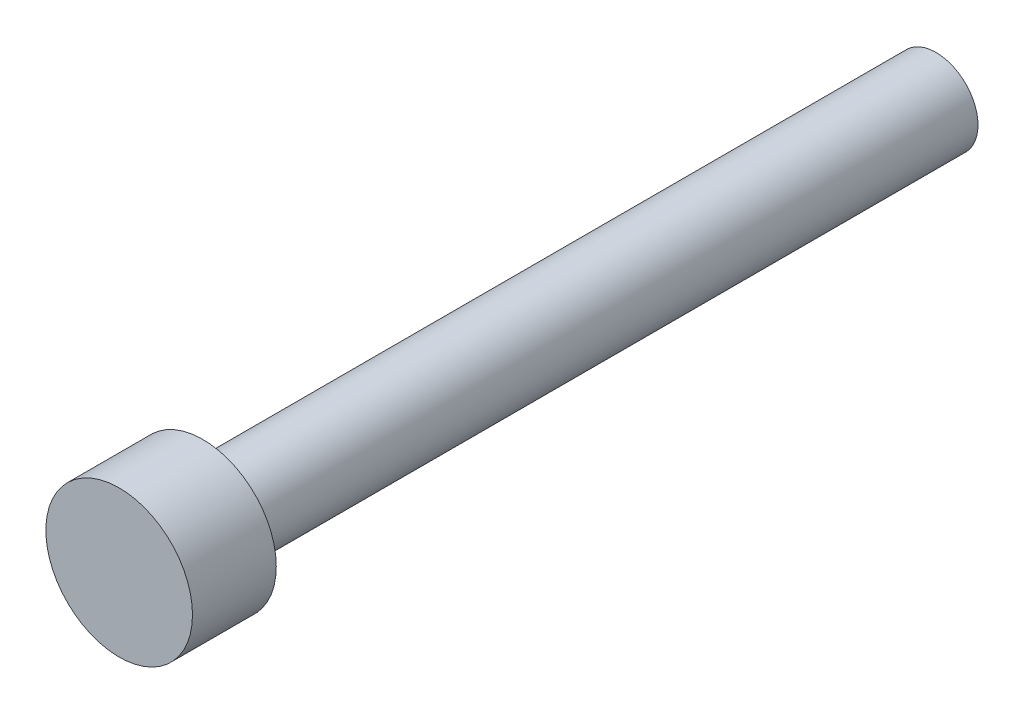
from build123d import *

# Parameters (mm, degrees)
SHANK_NOMINAL_THREAD_ENVELOPE_START     = -35
SHANK_NOMINAL_THREAD_ENVELOPE_PROFILE_R = 2
SHANK_NOMINAL_THREAD_ENVELOPE_DEPTH     = 35
SOCKET_HEAD_ENVELOPE_PROFILE_R          = 3.5
SOCKET_HEAD_ENVELOPE_DEPTH              = 4


with BuildPart() as part:
    # Shank_nominal_thread_envelope_profile → Shank_nominal_thread_envelope (new body)
    with BuildSketch(Plane.XY.offset(SHANK_NOMINAL_THREAD_ENVELOPE_START)):
        Circle(SHANK_NOMINAL_THREAD_ENVELOPE_PROFILE_R)
    extrude(amount=SHANK_NOMINAL_THREAD_ENVELOPE_DEPTH)

    # Socket_head_envelope_profile → Socket_head_envelope (add)
    with BuildSketch(Plane.XY):
        Circle(SOCKET_HEAD_ENVELOPE_PROFILE_R)
    extrude(amount=SOCKET_HEAD_ENVELOPE_DEPTH)


solid = part.part
